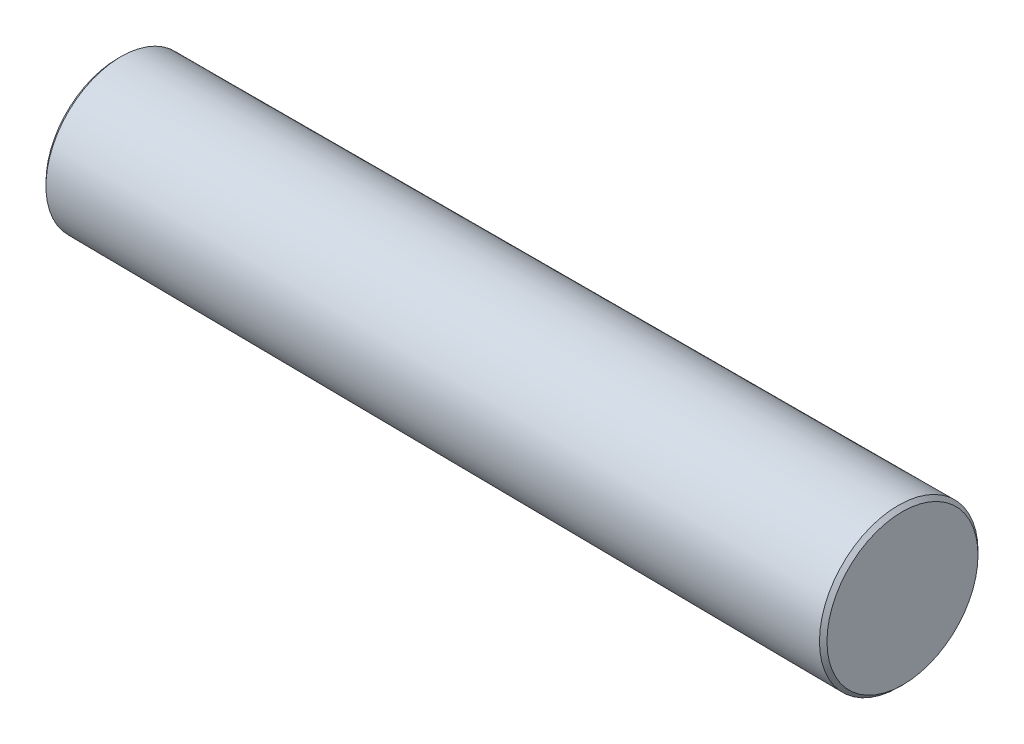
from build123d import *

# Parameters (mm, degrees)
CHAMFER10_SIZE = 0.1


with BuildPart() as part:
    # Sketch3 → Revolve1 (revolve)
    with BuildSketch(Plane(origin=(0, 0, 0), x_dir=(1, 0, 0), z_dir=(0, 1, 0)), mode=Mode.PRIVATE) as revolve1_sk:
        Polygon((-10.5, 0), (10.5, -0.101291178), (10.5, 2), (-10.5, 2), align=None)
    revolve(revolve1_sk.sketch.rotate(Axis((-10.5, 0, 0), (0.9999883676601261, 0, 0.0048233333325164674)), 180), axis=Axis((-10.5, 0, 0), (0.9999883676601261, 0, 0.0048233333325164674)))

    # Chamfer10
    chamfer10_edges = [part.edges().sort_by_distance(p)[0] for p in [
        (10.5, 0, -2),
        (-10.5, 0, -2),
    ]]
    chamfer(chamfer10_edges, length=CHAMFER10_SIZE)


solid = part.part
